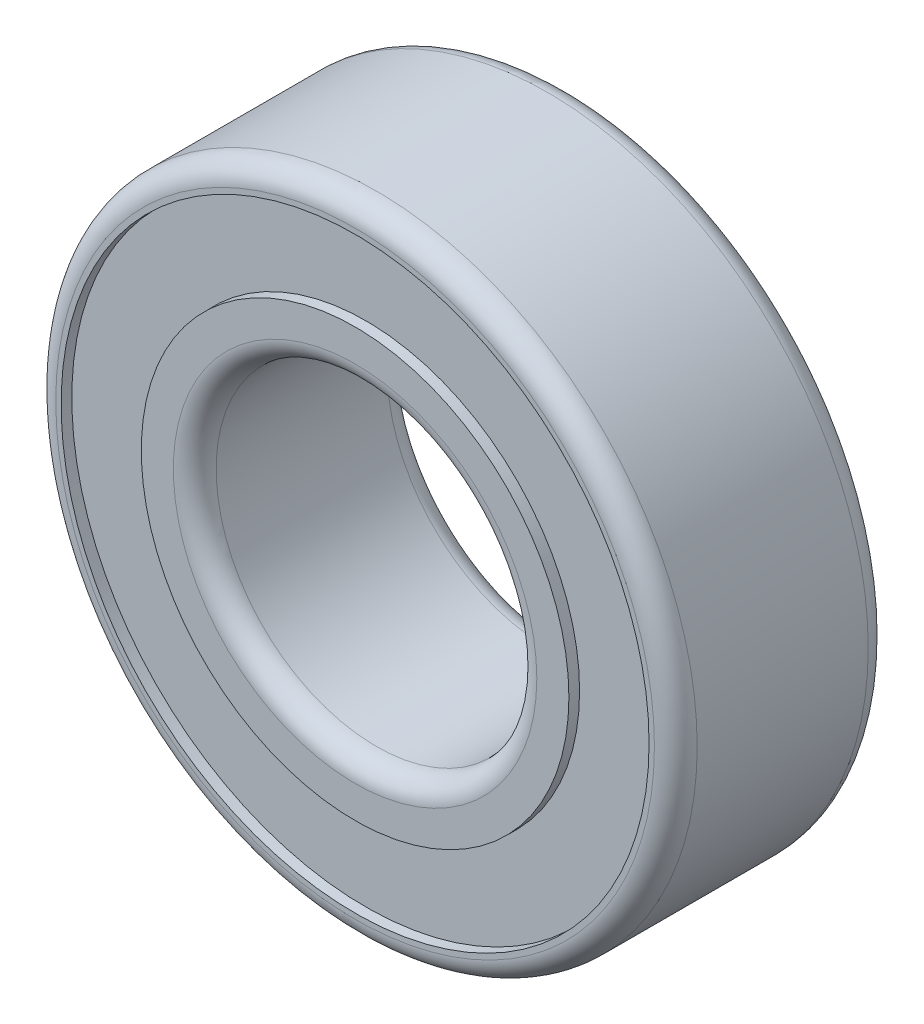
from build123d import *

# Parameters (mm, degrees)
SKETCH1_R           = 6
SKETCH1_R_2         = 3
BOSS_EXTRUDE1_DEPTH = 2
SKETCH2_R           = 5.5
SKETCH2_R_2         = 4
CUT_EXTRUDE1_DEPTH  = 0.2
FILLET1_R           = 0.4


with BuildPart() as part:
    # Sketch1 → Boss-Extrude1 (new, symmetric)
    with BuildSketch(Plane.XY):
        Circle(SKETCH1_R)
        Circle(SKETCH1_R_2, mode=Mode.SUBTRACT)
    extrude(amount=BOSS_EXTRUDE1_DEPTH, both=True)

    # Sketch2 → Cut-Extrude1 (cut)
    with BuildSketch(Plane.XY.offset(2)):
        Circle(SKETCH2_R)
        Circle(SKETCH2_R_2, mode=Mode.SUBTRACT)
    cut_extrude1 = extrude(amount=-CUT_EXTRUDE1_DEPTH, mode=Mode.SUBTRACT)

    # Mirror1: Cut-Extrude1 across plane
    add(cut_extrude1.mirror(Plane.XY), mode=Mode.SUBTRACT)

    # Fillet1
    fillet1_edges = [part.edges().sort_by_distance(p)[0] for p in [
        (-6, 0, -2),
        (-6, 0, 2),
        (-3, 0, -2),
        (-3, 0, 2),
    ]]
    fillet(fillet1_edges, radius=FILLET1_R)


solid = part.part
